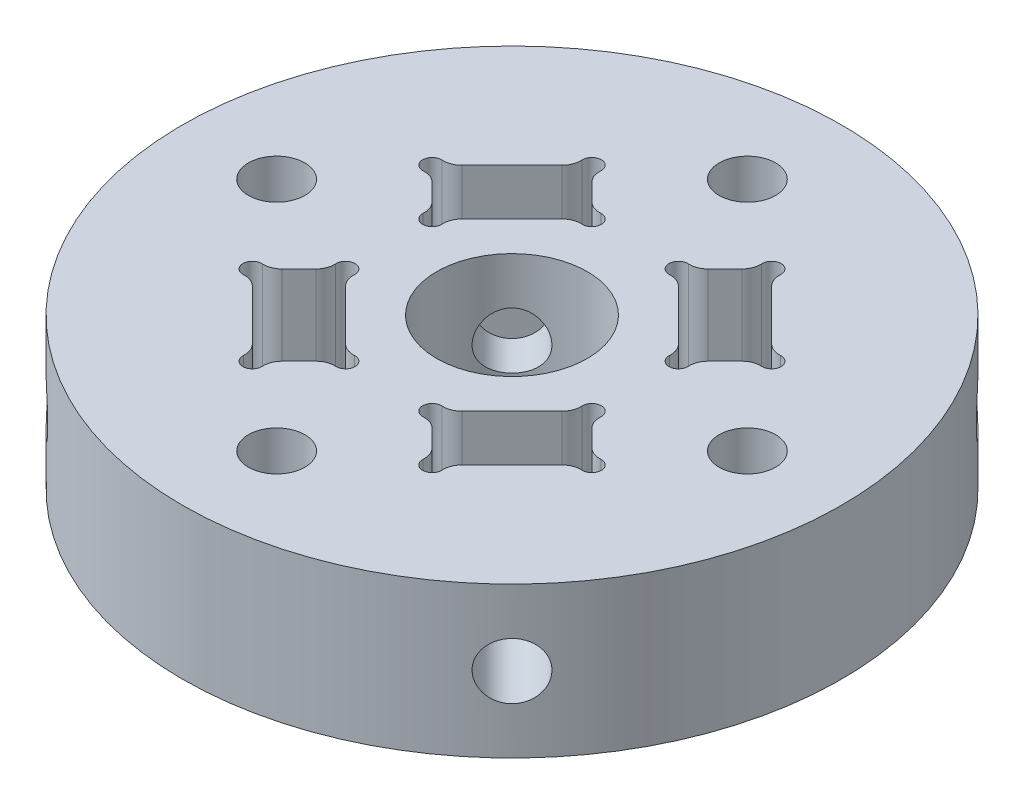
from build123d import *

# Parameters (mm, degrees)
SKETCH1_R           = 17.5
SKETCH1_R_2         = 1.5
BOSS_EXTRUDE1_DEPTH = 8
FILLET1_R           = 1
SKETCH3_R           = 1.5
CUT_EXTRUDE1_DEPTH  = 19
CIRPATTERN1_COUNT   = 4


with BuildPart() as part:
    # Sketch1 → Boss-Extrude1 (new body)
    with BuildSketch(Plane(origin=(0, 0, 0), x_dir=(1, 0, 0), z_dir=(0, 1, 0))):
        with Locations(Location((0, 0, 0), (0, 0, 270))):
            Circle(SKETCH1_R)
        with Locations(Location((0, 12.5, 0), (0, 0, 270))):
            Circle(SKETCH1_R_2, mode=Mode.SUBTRACT)
        with Locations(Location((12.5, 0, 0), (0, 0, 270))):
            Circle(SKETCH1_R_2, mode=Mode.SUBTRACT)
        with Locations(Location((0, -12.5, 0), (0, 0, 270))):
            Circle(SKETCH1_R_2, mode=Mode.SUBTRACT)
        with Locations(Location((-12.5, 0, 0), (0, 0, 270))):
            Circle(SKETCH1_R_2, mode=Mode.SUBTRACT)
        with BuildLine():
            Line((-6.187184335, -2.651650429), (-2.651650429, -6.187184335))
            ThreePointArc((-2.651650429, -6.187184335), (-1.798097039, -6.540737726), (-2.651650429, -6.894291117))
            Line((-2.651650429, -6.894291117), (-4.419417382, -8.66205807))
            ThreePointArc((-4.419417382, -8.66205807), (-4.772970773, -9.51561146), (-5.126524164, -8.66205807))
            Line((-5.126524164, -8.66205807), (-8.66205807, -5.126524164))
            ThreePointArc((-8.66205807, -5.126524164), (-9.51561146, -4.772970773), (-8.66205807, -4.419417382))
            Line((-8.66205807, -4.419417382), (-6.894291117, -2.651650429))
            ThreePointArc((-6.894291117, -2.651650429), (-6.540737726, -1.798097039), (-6.187184335, -2.651650429))
        make_face(mode=Mode.SUBTRACT)
        with BuildLine():
            Line((2.651650429, -6.187184335), (6.187184335, -2.651650429))
            ThreePointArc((6.187184335, -2.651650429), (6.540737726, -1.798097039), (6.894291117, -2.651650429))
            Line((6.894291117, -2.651650429), (8.66205807, -4.419417382))
            ThreePointArc((8.66205807, -4.419417382), (9.51561146, -4.772970773), (8.66205807, -5.126524164))
            Line((8.66205807, -5.126524164), (5.126524164, -8.66205807))
            ThreePointArc((5.126524164, -8.66205807), (4.772970773, -9.51561146), (4.419417382, -8.66205807))
            Line((4.419417382, -8.66205807), (2.651650429, -6.894291117))
            ThreePointArc((2.651650429, -6.894291117), (1.798097039, -6.540737726), (2.651650429, -6.187184335))
        make_face(mode=Mode.SUBTRACT)
        with BuildLine():
            Line((-2.651650429, 6.187184335), (-4.419417382, 4.419417382))
            Line((-4.419417382, 4.419417382), (-6.187184335, 2.651650429))
            ThreePointArc((-6.187184335, 2.651650429), (-6.540737726, 1.798097039), (-6.894291117, 2.651650429))
            Line((-6.894291117, 2.651650429), (-8.66205807, 4.419417382))
            ThreePointArc((-8.66205807, 4.419417382), (-9.51561146, 4.772970773), (-8.66205807, 5.126524164))
            Line((-8.66205807, 5.126524164), (-6.894291117, 6.894291117))
            Line((-6.894291117, 6.894291117), (-5.126524164, 8.66205807))
            ThreePointArc((-5.126524164, 8.66205807), (-4.772970773, 9.51561146), (-4.419417382, 8.66205807))
            Line((-4.419417382, 8.66205807), (-2.651650429, 6.894291117))
            ThreePointArc((-2.651650429, 6.894291117), (-1.798097039, 6.540737726), (-2.651650429, 6.187184335))
        make_face(mode=Mode.SUBTRACT)
        with BuildLine():
            ThreePointArc((-2.828427125, 2.828427125), (-1.530733729, 3.69551813), (0, 4))
            ThreePointArc((0, 4), (1.530733729, -3.69551813), (-2.828427125, 2.828427125))
        make_face(mode=Mode.SUBTRACT)
        with BuildLine():
            Line((6.187184335, 2.651650429), (2.651650429, 6.187184335))
            ThreePointArc((2.651650429, 6.187184335), (1.798097039, 6.540737726), (2.651650429, 6.894291117))
            Line((2.651650429, 6.894291117), (4.419417382, 8.66205807))
            ThreePointArc((4.419417382, 8.66205807), (4.772970773, 9.51561146), (5.126524164, 8.66205807))
            Line((5.126524164, 8.66205807), (8.66205807, 5.126524164))
            ThreePointArc((8.66205807, 5.126524164), (9.51561146, 4.772970773), (8.66205807, 4.419417382))
            Line((8.66205807, 4.419417382), (6.894291117, 2.651650429))
            ThreePointArc((6.894291117, 2.651650429), (6.540737726, 1.798097039), (6.187184335, 2.651650429))
        make_face(mode=Mode.SUBTRACT)
    extrude(amount=BOSS_EXTRUDE1_DEPTH)

    # Fillet1
    fillet1_edges = [part.edges().sort_by_distance(p)[0] for p in [
        (4.419417382, 4, -8.66205807),
        (2.651650429, 4, -6.894291117),
        (2.651650429, 4, -6.187184335),
        (6.187184335, 4, -2.651650429),
        (6.894291117, 4, -2.651650429),
        (8.66205807, 4, -4.419417382),
        (8.66205807, 4, -5.126524164),
        (5.126524164, 4, -8.66205807),
        (8.66205807, 4, 4.419417382),
        (6.894291117, 4, 2.651650429),
        (6.187184335, 4, 2.651650429),
        (2.651650429, 4, 6.187184335),
        (2.651650429, 4, 6.894291117),
        (4.419417382, 4, 8.66205807),
        (5.126524164, 4, 8.66205807),
        (8.66205807, 4, 5.126524164),
        (-4.419417382, 4, 8.66205807),
        (-2.651650429, 4, 6.894291117),
        (-2.651650429, 4, 6.187184335),
        (-6.187184335, 4, 2.651650429),
        (-6.894291117, 4, 2.651650429),
        (-8.66205807, 4, 4.419417382),
        (-8.66205807, 4, 5.126524164),
        (-5.126524164, 4, 8.66205807),
        (-2.651650429, 4, -6.187184335),
        (-2.651650429, 4, -6.894291117),
        (-4.419417382, 4, -8.66205807),
        (-5.126524164, 4, -8.66205807),
        (-8.66205807, 4, -5.126524164),
        (-8.66205807, 4, -4.419417382),
        (-6.894291117, 4, -2.651650429),
        (-6.187184335, 4, -2.651650429),
    ]]
    fillet(fillet1_edges, radius=FILLET1_R)

    # Sketch3 → Cut-Extrude1 (cut)
    with BuildSketch(Plane(origin=(12.374368671, 8, 12.374368671), x_dir=(0.7071067811864701, 0, -0.7071067811866251), z_dir=(0.7071067811866251, 0, 0.7071067811864701))):
        with Locations((0, -4)):
            Circle(SKETCH3_R)
    cut_extrude1 = extrude(amount=-CUT_EXTRUDE1_DEPTH, mode=Mode.SUBTRACT)

    # CirPattern1: Cut-Extrude1 ×4 about axis
    cirpattern1_axis = Axis((0, 8, 0), (0, 1, 0))
    for i in range(1, CIRPATTERN1_COUNT):
        add(cut_extrude1.rotate(cirpattern1_axis, i * 360 / CIRPATTERN1_COUNT), mode=Mode.SUBTRACT)


solid = part.part
